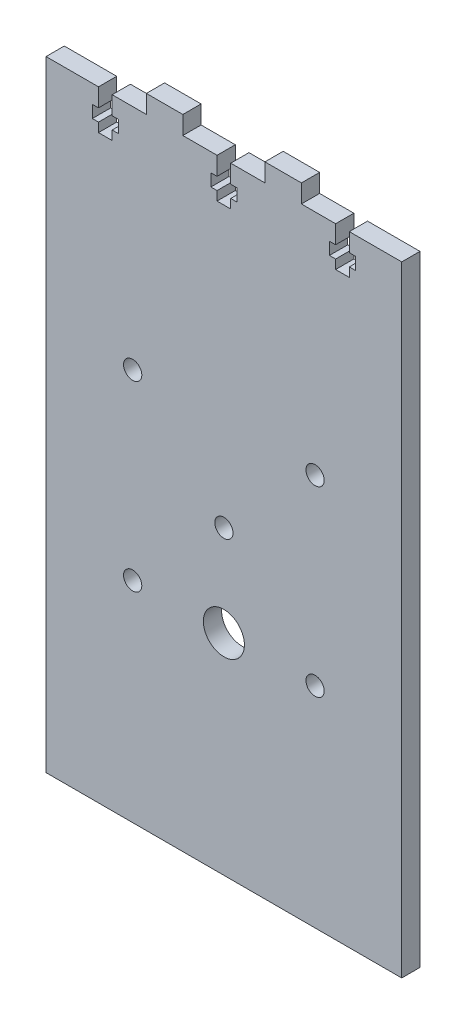
from build123d import *

# Parameters (mm, degrees)
SKETCH_1_R      = 4.5
SKETCH_1_R_2    = 2
EXTRUDE_1_DEPTH = 4


with BuildPart() as part:
    # 草图1 → 凸台-拉伸1 (new body)
    with BuildSketch(Plane.XY):
        Polygon((-39, 90), (-39, -46), (39, -46), (39, 90), (27.5, 90), (27.5, 86), (28.85, 86), (28.85, 83.3), (27.5, 83.3), (27.5, 81.3), (24.5, 81.3), (24.5, 83.3), (23.15, 83.3), (23.15, 86), (24.5, 86), (24.5, 90), (17, 90), (17, 94), (9, 94), (9, 90), (1.5, 90), (1.5, 86), (2.85, 86), (2.85, 83.3), (1.5, 83.3), (1.5, 81.3), (-1.5, 81.3), (-1.5, 83.3), (-2.85, 83.3), (-2.85, 86), (-1.5, 86), (-1.5, 90), (-9, 90), (-9, 94), (-17, 94), (-17, 90), (-24.5, 90), (-24.5, 86), (-23.15, 86), (-23.15, 83.3), (-24.5, 83.3), (-24.5, 81.3), (-27.5, 81.3), (-27.5, 83.3), (-28.85, 83.3), (-28.85, 86), (-27.5, 86), (-27.5, 90), align=None)
        Circle(SKETCH_1_R, mode=Mode.SUBTRACT)
        with Locations((20, 0)):
            Circle(SKETCH_1_R_2, mode=Mode.SUBTRACT)
        with Locations((0, 20)):
            Circle(SKETCH_1_R_2, mode=Mode.SUBTRACT)
        with Locations((-20, 40)):
            Circle(SKETCH_1_R_2, mode=Mode.SUBTRACT)
        with Locations((-20, 0)):
            Circle(SKETCH_1_R_2, mode=Mode.SUBTRACT)
        with Locations((20, 40)):
            Circle(SKETCH_1_R_2, mode=Mode.SUBTRACT)
    extrude(amount=EXTRUDE_1_DEPTH)


solid = part.part
